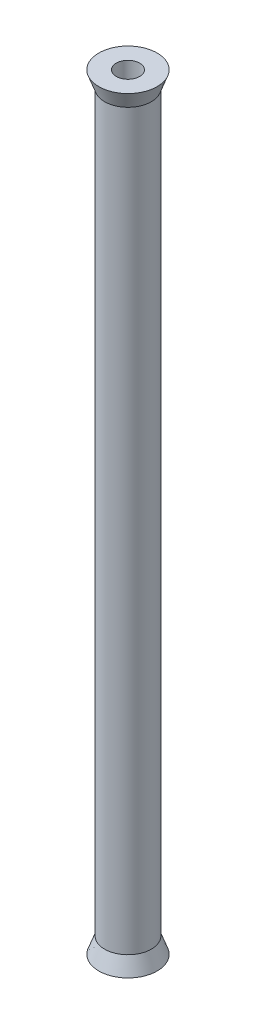
from build123d import *


with BuildPart() as part:
    # Sketch1 → Revolve1 (revolve)
    with BuildSketch(Plane.XY, mode=Mode.PRIVATE) as revolve1_sk:
        Polygon((2, -65.7), (5, -65.7), (4, -62.952522581), (4, 62.952522581), (5, 65.7), (2, 65.7), align=None)
    revolve(revolve1_sk.sketch.rotate(Axis((0, 0, 0), (0, -1, 0)), 90), axis=Axis((0, 0, 0), (0, -1, 0)))


solid = part.part
